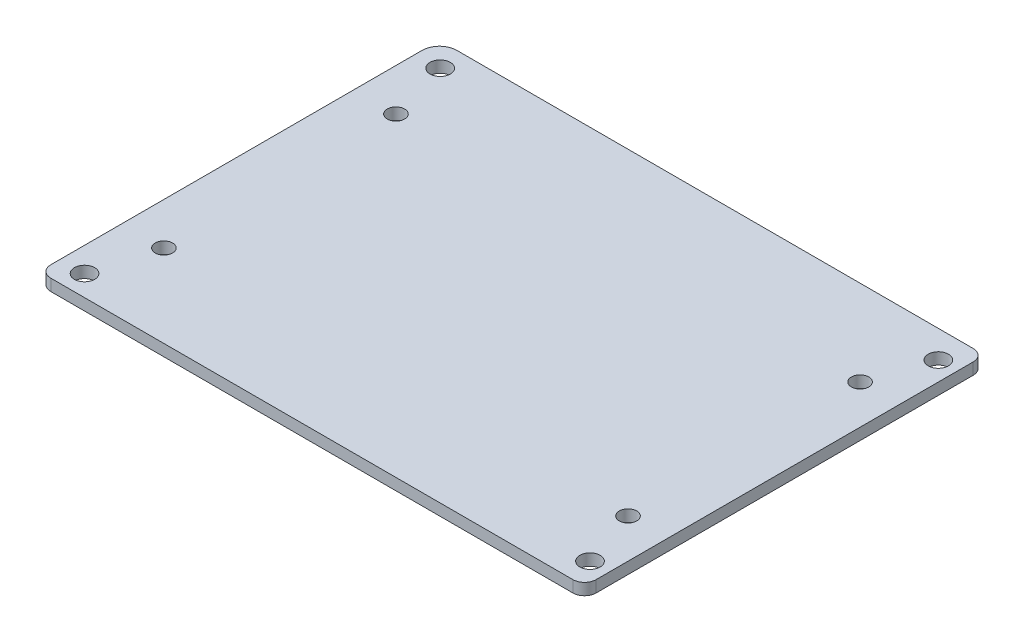
from build123d import *

# Parameters (mm, degrees)
SKETCH_1_R          = 1.75
EXTRUDE_1_DEPTH     = 2
SKETCH_3_R          = 1.5
CUT_EXTRUDE_1_DEPTH = 10


with BuildPart() as part:
    # 草图1 → 凸台-拉伸1 (new body)
    with BuildSketch(Plane(origin=(0, 0, 0), x_dir=(1, 0, 0), z_dir=(0, 1, 0))):
        with BuildLine():
            Line((-44.248197972, 34.748679798), (44.751802028, 34.748679798))
            ThreePointArc((44.751802028, 34.748679798), (46.16601559, 34.16289336), (46.751802028, 32.748679798))
            Line((46.751802028, 32.748679798), (46.751802028, -32.251320202))
            ThreePointArc((46.751802028, -32.251320202), (46.16601559, -33.665533764), (44.751802028, -34.251320202))
            Line((44.751802028, -34.251320202), (-45.248197972, -34.251320202))
            ThreePointArc((-45.248197972, -34.251320202), (-46.662411535, -33.665533764), (-47.248197972, -32.251320202))
            Line((-47.248197972, -32.251320202), (-47.248197972, 31.748679798))
            ThreePointArc((-47.248197972, 31.748679798), (-46.369518316, 33.870000142), (-44.248197972, 34.748679798))
        make_face()
        with Locations(Location((-43.029034064, 30.65, 0), (0, 0, 270))):
            Circle(SKETCH_1_R, mode=Mode.SUBTRACT)
        with Locations(Location((43.468694969, 30.023204862, 0), (0, 0, 90))):
            Circle(SKETCH_1_R, mode=Mode.SUBTRACT)
        with Locations(Location((43.468694969, -30.023204862, 0), (0, 0, 270))):
            Circle(SKETCH_1_R, mode=Mode.SUBTRACT)
        with Locations(Location((-43.029034064, -30.65, 0), (0, 0, 90))):
            Circle(SKETCH_1_R, mode=Mode.SUBTRACT)
    extrude(amount=EXTRUDE_1_DEPTH)

    # 草图3 → 切除-拉伸1 (cut)
    with BuildSketch(Plane(origin=(0, 2, 0), x_dir=(1, 0, 0), z_dir=(0, 1, 0))):
        with Locations(Location((-40, -20, 0), (0, 0, 270))):
            Circle(SKETCH_3_R)
        with Locations(Location((40, -20, 0), (0, 0, 270))):
            Circle(SKETCH_3_R)
        with Locations(Location((40, 20, 0), (0, 0, 270))):
            Circle(SKETCH_3_R)
        with Locations(Location((-40, 20, 0), (0, 0, 270))):
            Circle(SKETCH_3_R)
    extrude(amount=-CUT_EXTRUDE_1_DEPTH, mode=Mode.SUBTRACT)


solid = part.part
